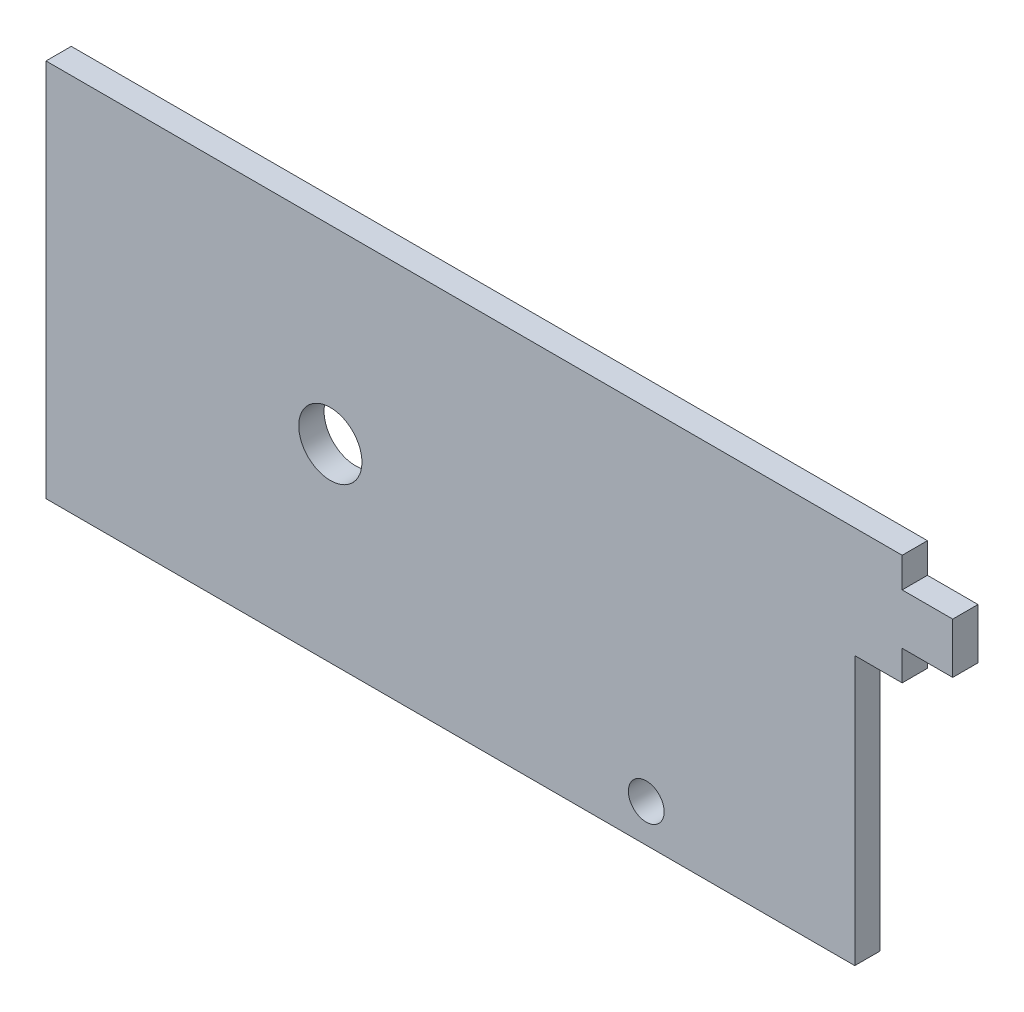
from build123d import *

# Parameters (mm, degrees)
SKETCH1_R           = 5
SKETCH1_R_2         = 2.83
BOSS_EXTRUDE1_DEPTH = 4


with BuildPart() as part:
    # Sketch1 → Boss-Extrude1 (new body)
    with BuildSketch(Plane.XY):
        Polygon((47, 30), (54.5, 30), (54.5, 25.25), (62.5, 25.25), (62.5, 17.25), (54.5, 17.25), (54.5, 12.5), (47, 12.5), (47, -30), (-81, -30), (-81, 30), align=None)
        with Locations((-36, 0)):
            Circle(SKETCH1_R, mode=Mode.SUBTRACT)
        with Locations((14, -24)):
            Circle(SKETCH1_R_2, mode=Mode.SUBTRACT)
    extrude(amount=BOSS_EXTRUDE1_DEPTH)


solid = part.part
